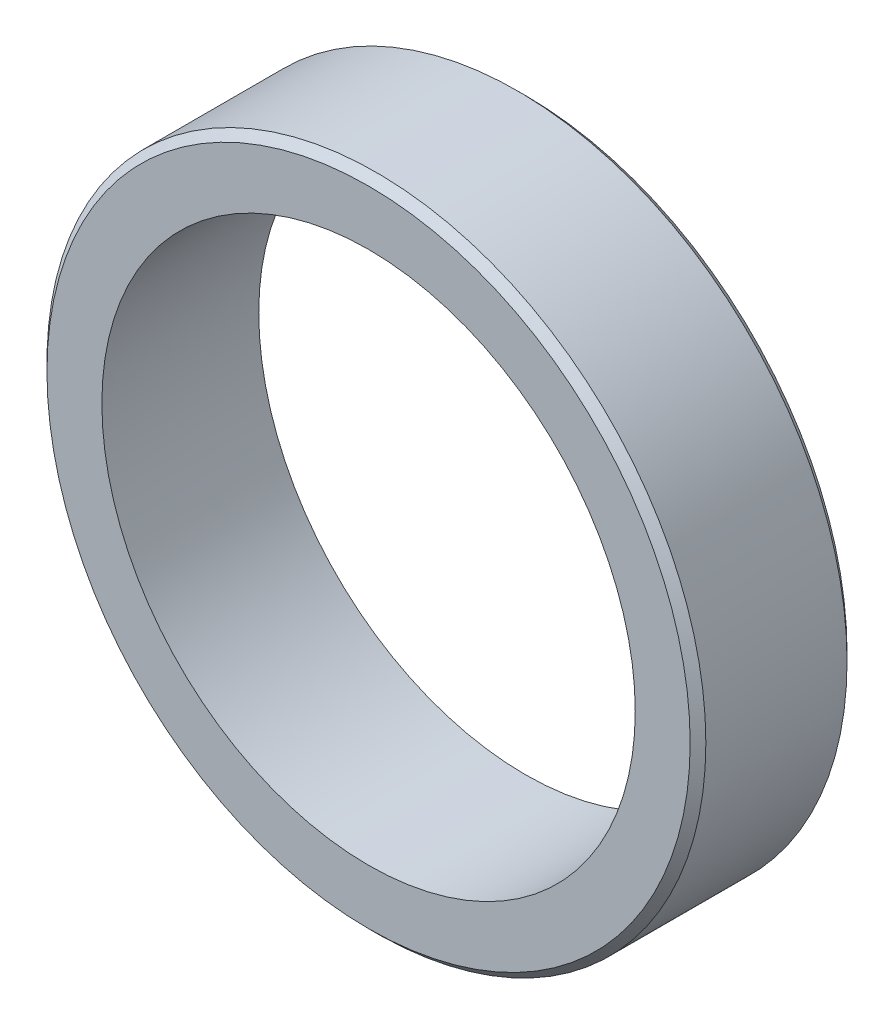
from build123d import *

# Parameters (mm, degrees)
SKETCH_1_R      = 420
SKETCH_1_R_2    = 340
EXTRUDE_1_DEPTH = 100
CHAMFER_1_SIZE  = 10


with BuildPart() as part:
    # 草图1 → 凸台-拉伸1 (new, symmetric)
    with BuildSketch(Plane.XY):
        Circle(SKETCH_1_R)
        Circle(SKETCH_1_R_2, mode=Mode.SUBTRACT)
    extrude(amount=EXTRUDE_1_DEPTH, both=True)

    # 倒角1
    chamfer_1_edges = [part.edges().sort_by_distance(p)[0] for p in [
        (-420, 0, -100),
        (-420, 0, 100),
    ]]
    chamfer(chamfer_1_edges, length=CHAMFER_1_SIZE)


solid = part.part
